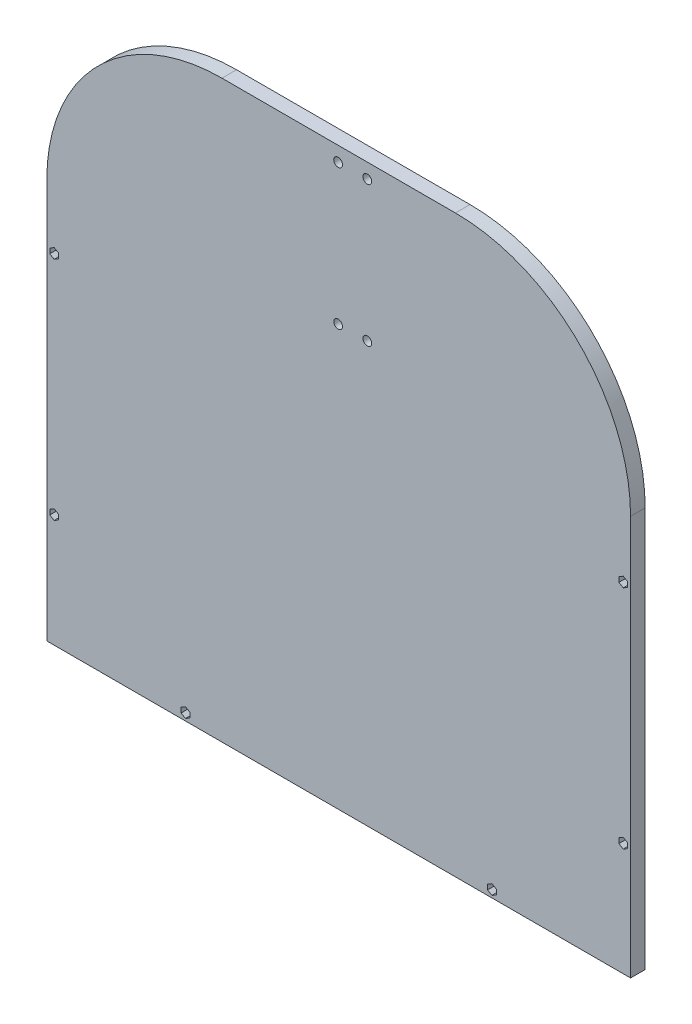
from build123d import *

# Parameters (mm, degrees)
ESQUISSE1_W             = 200
ESQUISSE1_H             = 155
BOSS_EXTRU_1_DEPTH      = 5
ENL_V_MAT_EXTRU_1_DEPTH = 127.614572621
ESQUISSE4_W             = 200
ESQUISSE4_H             = 5
BOSS_EXTRU_2_DEPTH      = 42
CONG_1_R                = 60
ESQUISSE5_R             = 1.5
ENL_V_MAT_EXTRU_2_DEPTH = 17


with BuildPart() as part:
    # Esquisse1 → Boss.-Extru.1 (new body)
    with BuildSketch(Plane.XY):
        Rectangle(ESQUISSE1_W, ESQUISSE1_H)
    extrude(amount=BOSS_EXTRU_1_DEPTH)

    # Esquisse2 → Enlèv. mat.-Extru.1 (cut, through all)
    with BuildSketch(Plane.XY.offset(5)):
        Polygon((-96, 37.883974596), (-96, 39.616025404), (-97.5, 40.482050808), (-99, 39.616025404), (-99, 37.883974596), (-97.5, 37.017949192), align=None)
        Polygon((-97.5, -37.017949192), (-96, -37.883974596), (-96, -39.616025404), (-97.5, -40.482050808), (-99, -39.616025404), (-99, -37.883974596), align=None)
        Polygon((99, -37.883974596), (97.5, -37.017949192), (96, -37.883974596), (96, -39.616025404), (97.5, -40.482050808), (99, -39.616025404), align=None)
        Polygon((97.5, 37.017949192), (96, 37.883974596), (96, 39.616025404), (97.5, 40.482050808), (99, 39.616025404), (99, 37.883974596), align=None)
        Polygon((-51, -75.866025404), (-51, -74.133974596), (-52.5, -73.267949192), (-54, -74.133974596), (-54, -75.866025404), (-52.5, -76.732050808), align=None)
        Polygon((52.5, -76.732050808), (51, -75.866025404), (51, -74.133974596), (52.5, -73.267949192), (54, -74.133974596), (54, -75.866025404), align=None)
    extrude(amount=-ENL_V_MAT_EXTRU_1_DEPTH, mode=Mode.SUBTRACT)

    # Esquisse4 → Boss.-Extru.2 (add)
    with BuildSketch(Plane(origin=(0, 77.5, 0), x_dir=(1, 0, 0), z_dir=(0, 1, 0))):
        with Locations((0, -2.5)):
            Rectangle(ESQUISSE4_W, ESQUISSE4_H)
    extrude(amount=BOSS_EXTRU_2_DEPTH)

    # Congé1
    cong_1_edges = [part.edges().sort_by_distance(p)[0] for p in [
        (100, 119.5, 2.5),
        (-100, 119.5, 2.5),
    ]]
    fillet(cong_1_edges, radius=CONG_1_R)

    # Esquisse5 → Enlèv. mat.-Extru.2 (cut)
    with BuildSketch(Plane(origin=(0, 0, 0), x_dir=(-1, 0, 0), z_dir=(0, 0, -1))):
        with Locations((-9.8, 66.447157523)):
            Circle(ESQUISSE5_R)
        with Locations((0.2, 66.447157523)):
            Circle(ESQUISSE5_R)
        with Locations((-9.8, 114.447157523)):
            Circle(ESQUISSE5_R)
        with Locations((0.2, 114.447157523)):
            Circle(ESQUISSE5_R)
    extrude(amount=-ENL_V_MAT_EXTRU_2_DEPTH, mode=Mode.SUBTRACT)


solid = part.part
